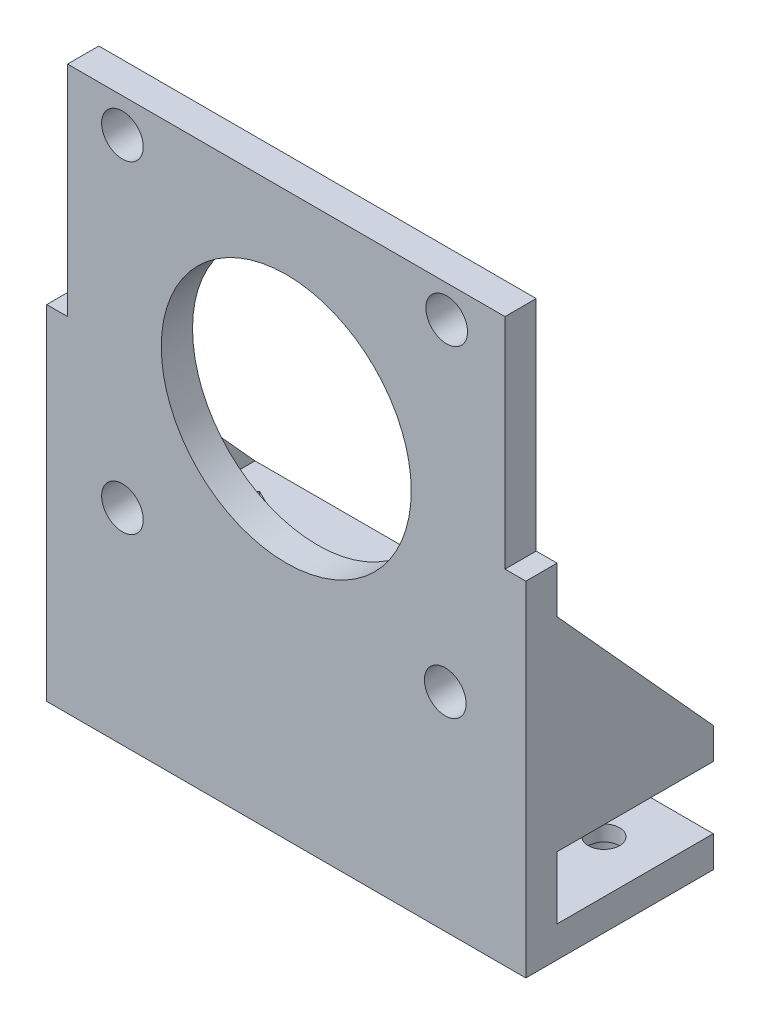
from build123d import *

# Parameters (mm, degrees)
ESBO_O1_R                = 2
ESBO_O1_R_2              = 12
ESBO_O1_W                = 46
ESBO_O1_H                = 6
ESBO_O1_H_2              = 3
RESSALTO_EXTRUS_O1_DEPTH = 3
ESBO_O1_3_W              = 46
ESBO_O1_3_H              = 3
RESSALTO_EXTRUS_O2_DEPTH = 15
ESBO_O2_R                = 2.25
ESBO_O2_R_2              = 1.5
CORTE_EXTRUS_O1_DEPTH    = 1.5
ESBO_O2_4_R              = 1.5
CORTE_EXTRUS_O3_DEPTH    = 61.580524923
RESSALTO_EXTRUS_O3_DEPTH = 2
RESSALTO_EXTRUS_O4_DEPTH = 2
CORTE_EXTRUS_O4_START    = -2
ESBO_O7_R                = 1.5
CORTE_EXTRUS_O4_DEPTH    = 2


with BuildPart() as part:
    # Esboço1 → Ressalto-extrusão1 (new body)
    # profile 1 of 4: a face of its own
    with BuildSketch(Plane.XY):
        Polygon((-23, -2), (-23, -23), (23, -23), (23, -2), (21, -2), (21, 19), (-21, 19), (-21, -2), align=None)
        with Locations((-15.731654435, -15.268345565)):
            Circle(ESBO_O1_R, mode=Mode.SUBTRACT)
        with Locations((15.26769418, -15.067384206)):
            Circle(ESBO_O1_R, mode=Mode.SUBTRACT)
        with Locations((-15.731654435, 15.731654435)):
            Circle(ESBO_O1_R, mode=Mode.SUBTRACT)
        Circle(ESBO_O1_R_2, mode=Mode.SUBTRACT)
        with Locations((15.404994987, 15.932311736)):
            Circle(ESBO_O1_R, mode=Mode.SUBTRACT)
    # profile 2 of 4: a face of its own
    with BuildSketch(Plane.XY):
        Polygon((23, -23), (-23, -23), (-23, -25), (-23, -26), (23, -26), (23, -25), align=None)
    # profile 3 of 4: a face of its own
    with BuildSketch(Plane.XY):
        with Locations((0, -29)):
            Rectangle(ESBO_O1_W, ESBO_O1_H)
    # profile 4 of 4: a face of its own
    with BuildSketch(Plane.XY):
        with Locations((0, -33.5)):
            Rectangle(ESBO_O1_W, ESBO_O1_H_2)
    extrude(amount=RESSALTO_EXTRUS_O1_DEPTH)

    # Esboço1<3> → Ressalto-extrusão2 (add)
    with BuildSketch(Plane.XY):
        Polygon((23, -23), (-23, -23), (-23, -25), (-23, -26), (23, -26), (23, -25), align=None)
        with Locations((0, -33.5)):
            Rectangle(ESBO_O1_3_W, ESBO_O1_3_H)
    extrude(amount=-RESSALTO_EXTRUS_O2_DEPTH)

    # Esboço2 → Corte-extrusão1 (cut)
    # profile 1 of 2: a face of its own
    with BuildSketch(Plane.XZ.offset(35)):
        with Locations(Location((-18, -9.5, 0), (0, 0, 270))):
            Circle(ESBO_O2_R)
        with Locations(Location((-18, -9.5, 0), (0, 0, 270))):
            Circle(ESBO_O2_R_2, mode=Mode.SUBTRACT)
    # profile 2 of 2: a face of its own
    with BuildSketch(Plane.XZ.offset(35)):
        with Locations(Location((18, -9.5, 0), (0, 0, 270))):
            Circle(ESBO_O2_R)
        with Locations(Location((18, -9.5, 0), (0, 0, 270))):
            Circle(ESBO_O2_R_2, mode=Mode.SUBTRACT)
    extrude(amount=-CORTE_EXTRUS_O1_DEPTH, mode=Mode.SUBTRACT)

    # Esboço2<4> → Corte-extrusão3 (cut, through all)
    with BuildSketch(Plane.XZ.offset(35)):
        with Locations(Location((-18, -9.5, 0), (0, 0, 270))):
            Circle(ESBO_O2_4_R)
        with Locations(Location((18, -9.5, 0), (0, 0, 270))):
            Circle(ESBO_O2_4_R)
    extrude(amount=-CORTE_EXTRUS_O3_DEPTH, mode=Mode.SUBTRACT)

    # Esboço5 → Ressalto-extrusão3 (add)
    with BuildSketch(Plane(origin=(23, 0, 0), x_dir=(0, 0, -1), z_dir=(1, 0, 0))):
        Polygon((15, -23), (0, -6.455375179), (0, -23), align=None)
    extrude(amount=-RESSALTO_EXTRUS_O3_DEPTH)

    # Esboço6 → Ressalto-extrusão4 (add)
    with BuildSketch(Plane.ZY.offset(23)):
        Polygon((-15, -23), (0, -23), (0, -6.455375179), align=None)
    extrude(amount=-RESSALTO_EXTRUS_O4_DEPTH)

    # Esboço7 → Corte-extrusão4 (cut)
    # profile 1 of 2: a face of its own
    with BuildSketch(Plane(origin=(0, -23, 0), x_dir=(1, 0, 0), z_dir=(0, 1, 0)).offset(CORTE_EXTRUS_O4_START)):
        Polygon((-20.632829264, 7.724741314), (-17.778995512, 6.332273631), (-15.146166248, 8.107532317), (-15.367170736, 11.275258686), (-18.221004488, 12.667726369), (-20.853833752, 10.892467683), align=None)
        with Locations((-18, 9.5)):
            Circle(ESBO_O7_R, mode=Mode.SUBTRACT)
    # profile 2 of 2: a face of its own
    with BuildSketch(Plane(origin=(0, -23, 0), x_dir=(1, 0, 0), z_dir=(0, 1, 0)).offset(CORTE_EXTRUS_O4_START)):
        Polygon((17.778995512, 6.332273631), (15.146166248, 8.107532317), (15.367170736, 11.275258686), (18.221004488, 12.667726369), (20.853833752, 10.892467683), (20.632829264, 7.724741314), align=None)
        with Locations((18, 9.5)):
            Circle(ESBO_O7_R, mode=Mode.SUBTRACT)
    extrude(amount=CORTE_EXTRUS_O4_DEPTH, mode=Mode.SUBTRACT)


solid = part.part
